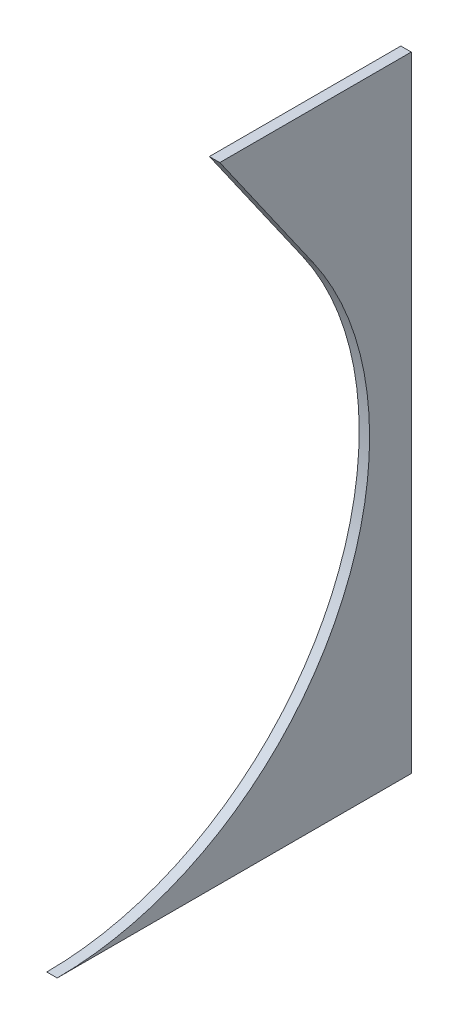
from build123d import *

# Parameters (mm, degrees)
SKETCH1_W           = 215.9
SKETCH1_H           = 381
BOSS_EXTRUDE1_DEPTH = 6.35
SKETCH2_R           = 190.5
CUT_EXTRUDE1_DEPTH  = 245.802296865
CUT_EXTRUDE2_DEPTH  = 245.802296865


with BuildPart() as part:
    # Sketch1 → Boss-Extrude1 (new body)
    with BuildSketch(Plane(origin=(0, 0, 0), x_dir=(0, 0, -1), z_dir=(1, 0, 0))):
        with Locations((12.7, 22.411764706)):
            Rectangle(SKETCH1_W, SKETCH1_H)
    extrude(amount=BOSS_EXTRUDE1_DEPTH)

    # Sketch2 → Cut-Extrude1 (cut, through all)
    with BuildSketch(Plane(origin=(6.35, 0, 0), x_dir=(0, 0, -1), z_dir=(1, 0, 0))):
        with Locations((-95.25, 22.411764706)):
            Circle(SKETCH2_R)
    extrude(amount=-CUT_EXTRUDE1_DEPTH, mode=Mode.SUBTRACT)

    # Sketch3 → Cut-Extrude2 (cut, through all)
    with BuildSketch(Plane(origin=(6.35, 0, 0), x_dir=(0, 0, -1), z_dir=(1, 0, 0))):
        Polygon((60.798464437, 131.678075831), (-18.968243734, 245.59674111), (-203.446235094, 245.59674111), (-203.446235094, 131.678075831), align=None)
    extrude(amount=-CUT_EXTRUDE2_DEPTH, mode=Mode.SUBTRACT)


solid = part.part
